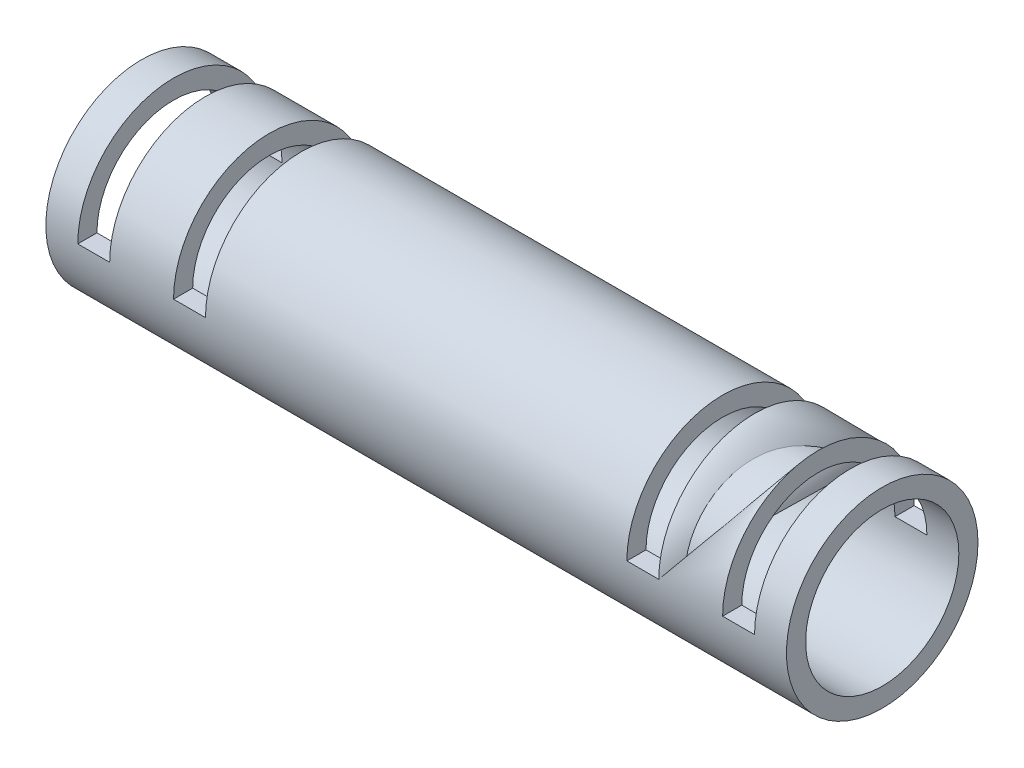
from build123d import *

# Parameters (mm, degrees)
SKETCH2_R           = 7.5
SKETCH2_R_2         = 6
BOSS_EXTRUDE1_DEPTH = 29
CUT_EXTRUDE1_REACH  = 32.879
SKETCH4_W           = 2.5
SKETCH4_H           = 15


with BuildPart() as part:
    # Sketch2 → Boss-Extrude1 (new, symmetric)
    with BuildSketch(Plane(origin=(0, 0, 0), x_dir=(0, 0, -1), z_dir=(1, 0, 0))):
        with Locations(Location((0, 0, 0), (0, 0, 180))):
            Circle(SKETCH2_R)
        with Locations(Location((0, 0, 0), (0, 0, 180))):
            Circle(SKETCH2_R_2, mode=Mode.SUBTRACT)
    extrude(amount=BOSS_EXTRUDE1_DEPTH, both=True)

    # Sketch4 → Cut-Extrude1 (cut, up to next)
    with BuildSketch(Plane(origin=(0, 0, 0), x_dir=(1, 0, 0), z_dir=(0, 1, 0)), mode=Mode.PRIVATE) as cut_extrude1_sk1:
        with Locations((25.25, 0)):
            Rectangle(SKETCH4_W, SKETCH4_H)
    cut_extrude1_tool1 = extrude(cut_extrude1_sk1.sketch, amount=CUT_EXTRUDE1_REACH, mode=Mode.PRIVATE) & part.part
    # Sketch4 → Cut-Extrude1 (cut, up to next)
    with BuildSketch(Plane(origin=(0, 0, 0), x_dir=(1, 0, 0), z_dir=(0, 1, 0)), mode=Mode.PRIVATE) as cut_extrude1_sk2:
        with Locations((17.75, 0)):
            Rectangle(SKETCH4_W, SKETCH4_H)
    cut_extrude1_tool2 = extrude(cut_extrude1_sk2.sketch, amount=CUT_EXTRUDE1_REACH, mode=Mode.PRIVATE) & part.part
    # Sketch4 → Cut-Extrude1 (cut, up to next)
    with BuildSketch(Plane(origin=(0, 0, 0), x_dir=(1, 0, 0), z_dir=(0, 1, 0)), mode=Mode.PRIVATE) as cut_extrude1_sk3:
        with Locations((-17.75, 0)):
            Rectangle(SKETCH4_W, SKETCH4_H)
    cut_extrude1_tool3 = extrude(cut_extrude1_sk3.sketch, amount=CUT_EXTRUDE1_REACH, mode=Mode.PRIVATE) & part.part
    # Sketch4 → Cut-Extrude1 (cut, up to next)
    with BuildSketch(Plane(origin=(0, 0, 0), x_dir=(1, 0, 0), z_dir=(0, 1, 0)), mode=Mode.PRIVATE) as cut_extrude1_sk4:
        with Locations((-25.25, 0)):
            Rectangle(SKETCH4_W, SKETCH4_H)
    cut_extrude1_tool4 = extrude(cut_extrude1_sk4.sketch, amount=CUT_EXTRUDE1_REACH, mode=Mode.PRIVATE) & part.part
    add(cut_extrude1_tool1.solids().sort_by_distance((25.25, 0, 0))[0], mode=Mode.SUBTRACT)
    add(cut_extrude1_tool2.solids().sort_by_distance((17.75, 0, 0))[0], mode=Mode.SUBTRACT)
    add(cut_extrude1_tool3.solids().sort_by_distance((-17.75, 0, 0))[0], mode=Mode.SUBTRACT)
    add(cut_extrude1_tool4.solids().sort_by_distance((-25.25, 0, 0))[0], mode=Mode.SUBTRACT)


solid = part.part
